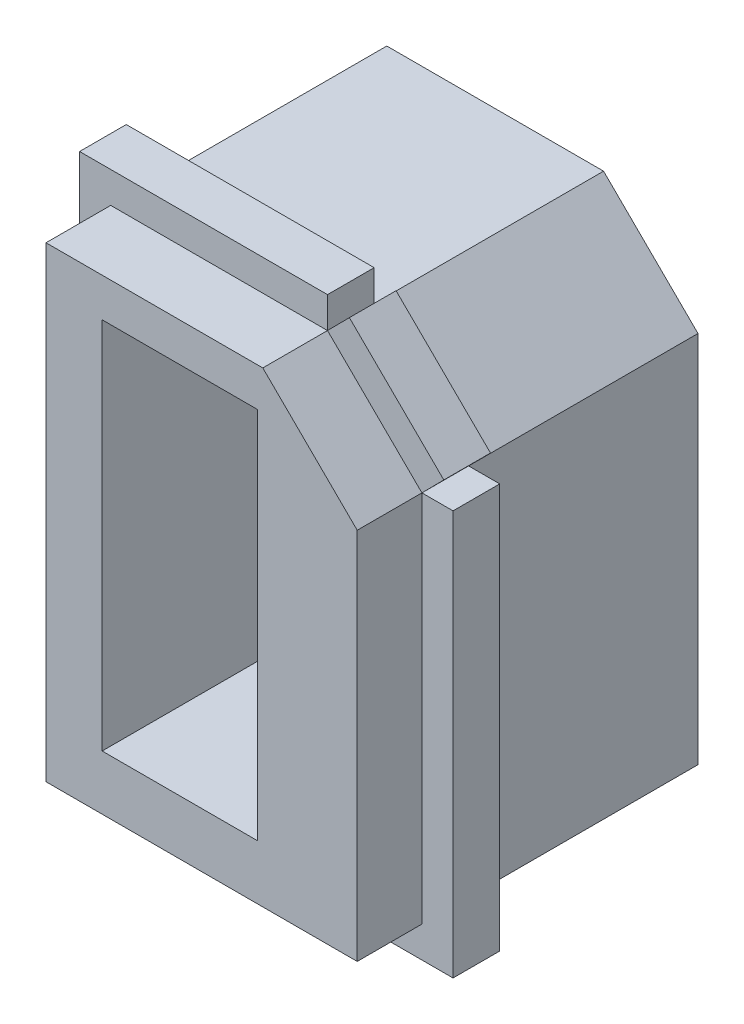
from build123d import *

# Parameters (mm, degrees)
SKETCH1_W           = 5
SKETCH1_H           = 12
BOSS_EXTRUDE1_DEPTH = 10.95
SKETCH6_W           = 6.966027875
SKETCH6_H           = 1.5
BOSS_EXTRUDE2_DEPTH = 1
SKETCH4_W           = 10
SKETCH4_H           = 1.5
BOSS_EXTRUDE4_DEPTH = 1
SKETCH9_W           = 1.5
SKETCH9_H           = 17
BOSS_EXTRUDE5_DEPTH = 1
SKETCH10_W          = 1.5
SKETCH10_H          = 13
BOSS_EXTRUDE6_DEPTH = 1
SKETCH11_W          = 4.266730231
SKETCH11_H          = 1.5
BOSS_EXTRUDE7_DEPTH = 1


with BuildPart() as part:
    # Sketch1 → Boss-Extrude1 (new body)
    with BuildSketch(Plane.XY):
        Polygon((0, 0), (-10, 0), (-10, 15), (-3.033972125, 15), (0, 12), align=None)
        with Locations((-5.696428571, 7.758057491)):
            Rectangle(SKETCH1_W, SKETCH1_H, mode=Mode.SUBTRACT)
    extrude(amount=BOSS_EXTRUDE1_DEPTH)

    # Sketch6 → Boss-Extrude2 (add)
    with BuildSketch(Plane(origin=(0, 15, 0), x_dir=(1, 0, 0), z_dir=(0, 1, 0))):
        with Locations((-6.516986063, -8.120873767)):
            Rectangle(SKETCH6_W, SKETCH6_H)
    extrude(amount=BOSS_EXTRUDE2_DEPTH)

    # Sketch4 → Boss-Extrude4 (add)
    with BuildSketch(Plane.XZ):
        with Locations((-5, 8.120873767)):
            Rectangle(SKETCH4_W, SKETCH4_H)
    extrude(amount=BOSS_EXTRUDE4_DEPTH)

    # Sketch9 → Boss-Extrude5 (add)
    with BuildSketch(Plane.ZY.offset(10)):
        with Locations((8.120873767, 7.5)):
            Rectangle(SKETCH9_W, SKETCH9_H)
    extrude(amount=BOSS_EXTRUDE5_DEPTH)

    # Sketch10 → Boss-Extrude6 (add)
    with BuildSketch(Plane(origin=(0, 0, 0), x_dir=(0, 0, -1), z_dir=(1, 0, 0))):
        with Locations((-8.120873767, 5.5)):
            Rectangle(SKETCH10_W, SKETCH10_H)
    extrude(amount=BOSS_EXTRUDE6_DEPTH)

    # Sketch11 → Boss-Extrude7 (add)
    with BuildSketch(Plane(origin=(5.99961963, 6.067559573, 0), x_dir=(0.7110766234784633, -0.7031145251966195, 0), z_dir=(0.7031145251966195, 0.7110766234784633, 0))):
        with Locations((-10.570739418, -8.120873767)):
            Rectangle(SKETCH11_W, SKETCH11_H)
    extrude(amount=BOSS_EXTRUDE7_DEPTH)


solid = part.part
